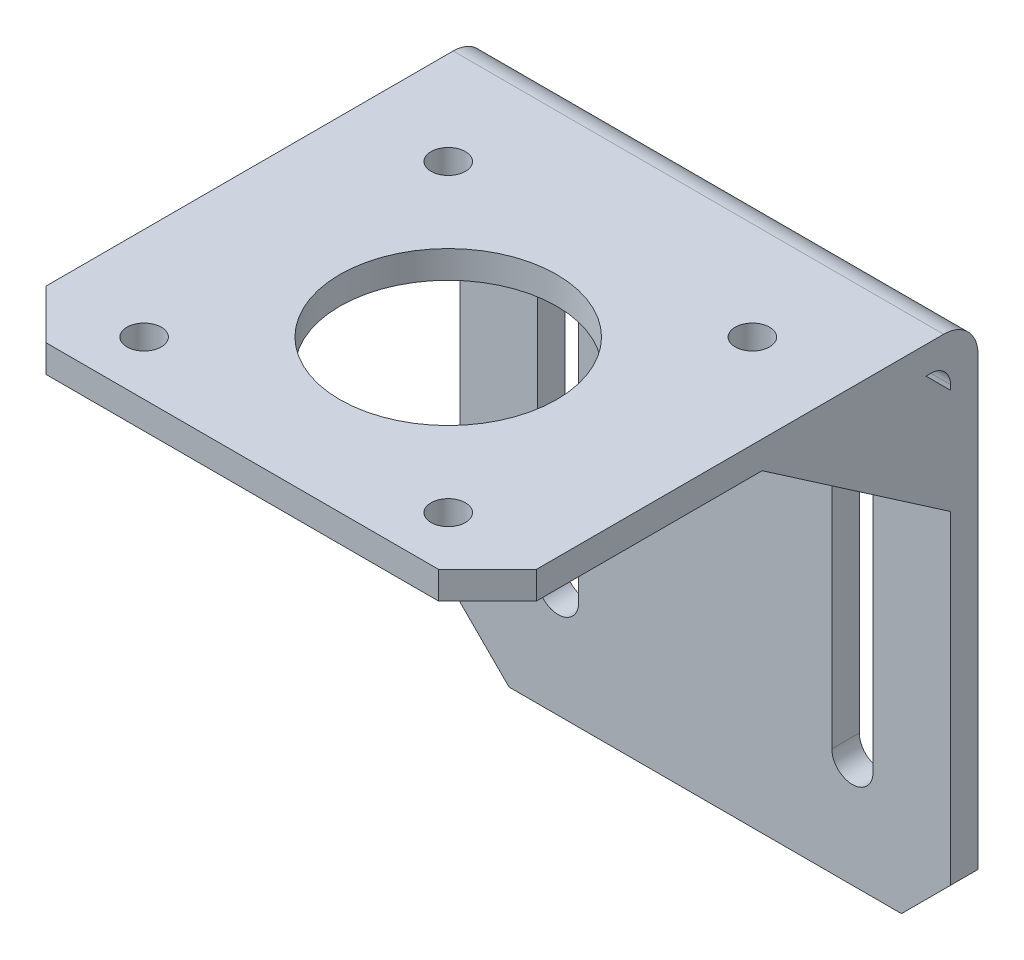
from build123d import *

# Parameters (mm, degrees)
BOSS_EXTRUDE1_DEPTH      = 25
BOSS_EXTRUDE1_DEPTH_BACK = 25
SKETCH3_R                = 11.05
SKETCH3_R_2              = 1.75
CUT_EXTRUDE1_DEPTH       = 78.723870207
CUT_EXTRUDE2_DEPTH       = 78.723870207
CHAMFER1_SIZE            = 5
FILLET1_R                = 2
FILLET2_R                = 3.5
BOSS_EXTRUDE2_DEPTH      = 2.5


with BuildPart() as part:
    # Sketch1 → Boss-Extrude1 (new, two sides: drawn at the far end of the back side and taken through both)
    with BuildSketch(Plane(origin=(0, 0, 0), x_dir=(0, 0, -1), z_dir=(1, 0, 0)).offset(-BOSS_EXTRUDE1_DEPTH_BACK)):
        Polygon((-50, 0), (-50, -2.8), (-2.8, -2.8), (-2.8, -54), (0, -54), (0, 0), align=None)
    extrude(amount=BOSS_EXTRUDE1_DEPTH + BOSS_EXTRUDE1_DEPTH_BACK)

    # Sketch3 → Cut-Extrude1 (cut, through all)
    with BuildSketch(Plane(origin=(0, 0, 0), x_dir=(1, 0, 0), z_dir=(0, 1, 0))):
        with Locations((0, -29)):
            Circle(SKETCH3_R)
        with Locations((-15.5, -13.5)):
            Circle(SKETCH3_R_2)
        with Locations((15.5, -13.5)):
            Circle(SKETCH3_R_2)
        with Locations((15.5, -44.5)):
            Circle(SKETCH3_R_2)
        with Locations((-15.5, -44.5)):
            Circle(SKETCH3_R_2)
    extrude(amount=-CUT_EXTRUDE1_DEPTH, mode=Mode.SUBTRACT)

    # Sketch4 → Cut-Extrude2 (cut, through all)
    with BuildSketch(Plane(origin=(0, 0, 0), x_dir=(-1, 0, 0), z_dir=(0, 0, -1))):
        with BuildLine():
            Line((-17.1, -43), (-17.1, -13))
            ThreePointArc((-17.1, -13), (-15, -10.9), (-12.9, -13))
            Line((-12.9, -13), (-12.9, -43))
            ThreePointArc((-12.9, -43), (-15, -45.1), (-17.1, -43))
        make_face()
        with BuildLine():
            Line((12.9, -43), (12.9, -13))
            ThreePointArc((12.9, -13), (15, -10.9), (17.1, -13))
            Line((17.1, -13), (17.1, -43))
            ThreePointArc((17.1, -43), (15, -45.1), (12.9, -43))
        make_face()
    extrude(amount=-CUT_EXTRUDE2_DEPTH, mode=Mode.SUBTRACT)

    # Chamfer1
    chamfer1_edges = [part.edges().sort_by_distance(p)[0] for p in [
        (25, -54, 1.4),
        (-25, -54, 1.4),
        (-25, -1.4, 50),
        (25, -1.4, 50),
    ]]
    chamfer(chamfer1_edges, length=CHAMFER1_SIZE)

    # Fillet1
    fillet1_edges = [part.edges().sort_by_distance(p)[0] for p in [
        (0, -2.8, 2.8),
    ]]
    fillet(fillet1_edges, radius=FILLET1_R)

    # Fillet2
    fillet2_edges = [part.edges().sort_by_distance(p)[0] for p in [
        (0, 0, 0),
    ]]
    fillet(fillet2_edges, radius=FILLET2_R)

    # Sketch5 → Boss-Extrude2 (add)
    with BuildSketch(Plane.ZY.offset(25)):
        Polygon((2.8, -5.3), (5.3, -2.8), (22, -2.8), (2.8, -16), align=None)
    boss_extrude2 = extrude(amount=-BOSS_EXTRUDE2_DEPTH)

    # Mirror1: Boss-Extrude2 across plane
    add(boss_extrude2.mirror(Plane(origin=(0, 0, 0), x_dir=(0, 0, 1), z_dir=(1, 0, 0))))


solid = part.part
